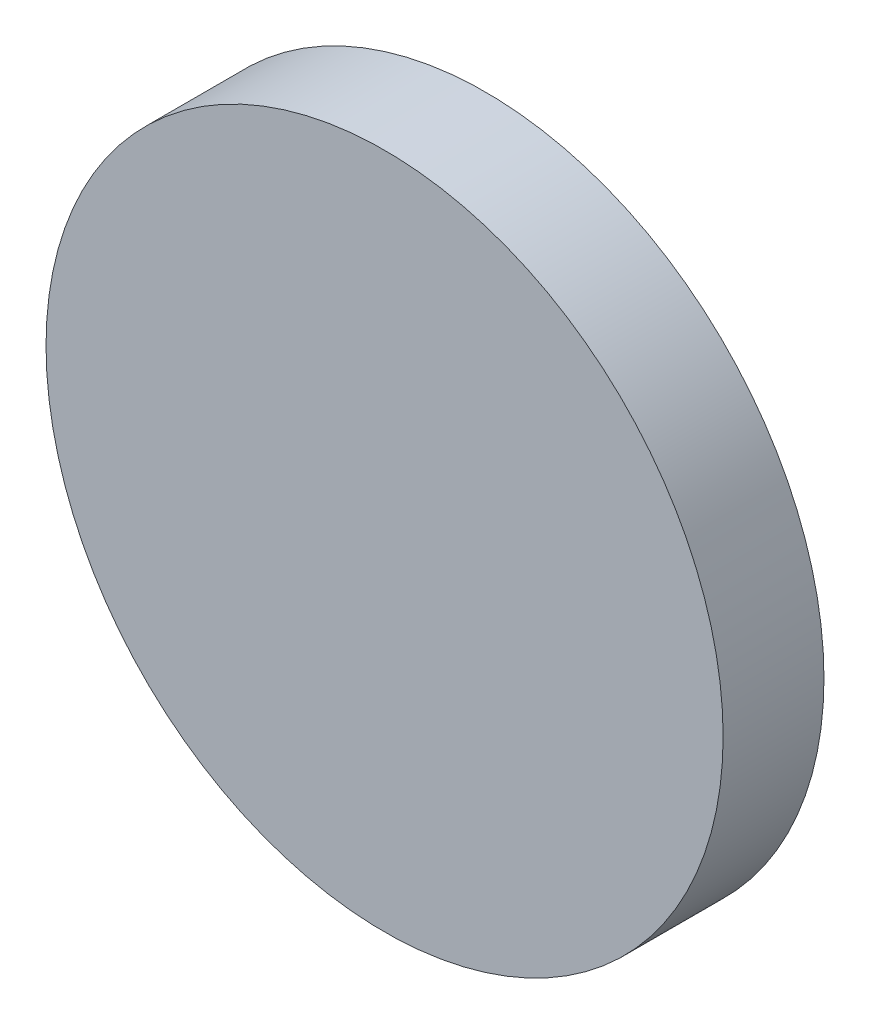
from build123d import *

# Parameters (mm, degrees)
SKETCH1_R           = 28.2
BOSS_EXTRUDE1_DEPTH = 8.4


with BuildPart() as part:
    # Sketch1 → Boss-Extrude1 (new body)
    with BuildSketch(Plane.XY):
        Circle(SKETCH1_R)
    extrude(amount=BOSS_EXTRUDE1_DEPTH)


solid = part.part
